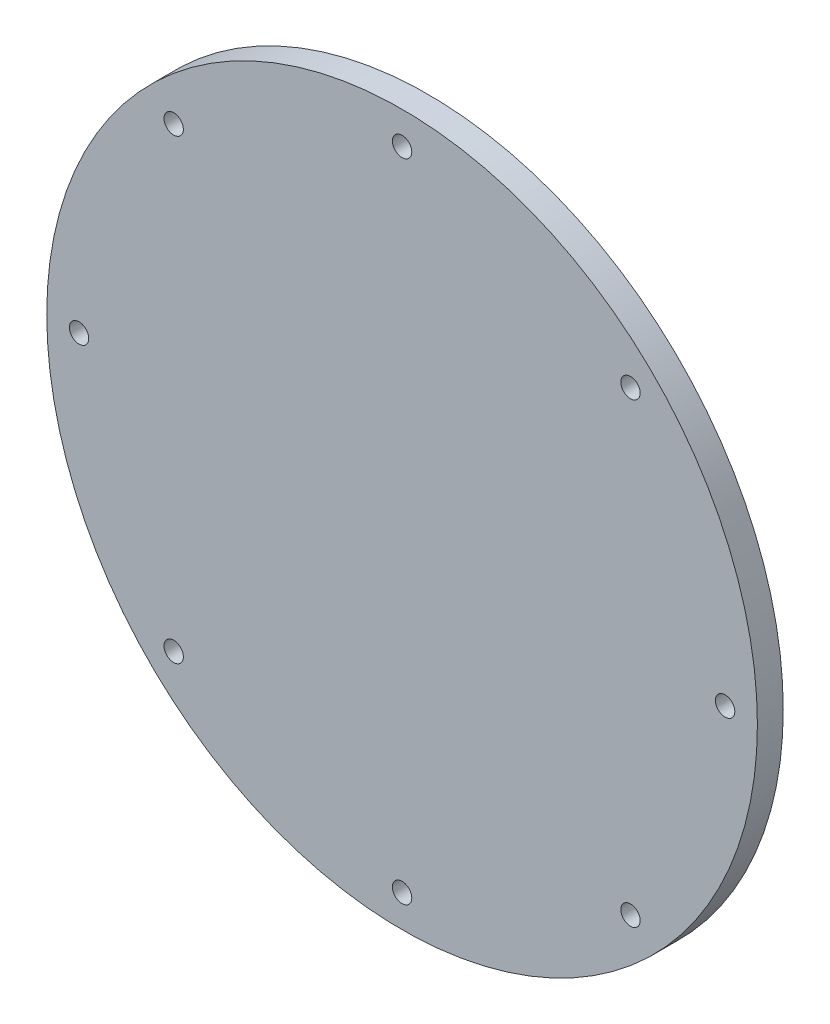
from build123d import *

# Parameters (mm, degrees)
SKETCH_1_R          = 110
EXTRUDE_1_DEPTH     = 8
SKETCH_2_R          = 3
CUT_EXTRUDE_1_DEPTH = 8


with BuildPart() as part:
    # 草图1 → 凸台-拉伸1 (new body)
    with BuildSketch(Plane.XY):
        Circle(SKETCH_1_R)
    extrude(amount=EXTRUDE_1_DEPTH)

    # 草图2 → 切除-拉伸1 (cut)
    with BuildSketch(Plane.XY.offset(8)):
        with Locations((0, 100)):
            Circle(SKETCH_2_R)
        with Locations((70.710678119, 70.710678119)):
            Circle(SKETCH_2_R)
        with Locations((100, 0)):
            Circle(SKETCH_2_R)
        with Locations((70.710678119, -70.710678119)):
            Circle(SKETCH_2_R)
        with Locations((0, -100)):
            Circle(SKETCH_2_R)
        with Locations((-70.710678119, -70.710678119)):
            Circle(SKETCH_2_R)
        with Locations((-100, 0)):
            Circle(SKETCH_2_R)
        with Locations((-70.710678119, 70.710678119)):
            Circle(SKETCH_2_R)
    extrude(amount=-CUT_EXTRUDE_1_DEPTH, mode=Mode.SUBTRACT)


solid = part.part
